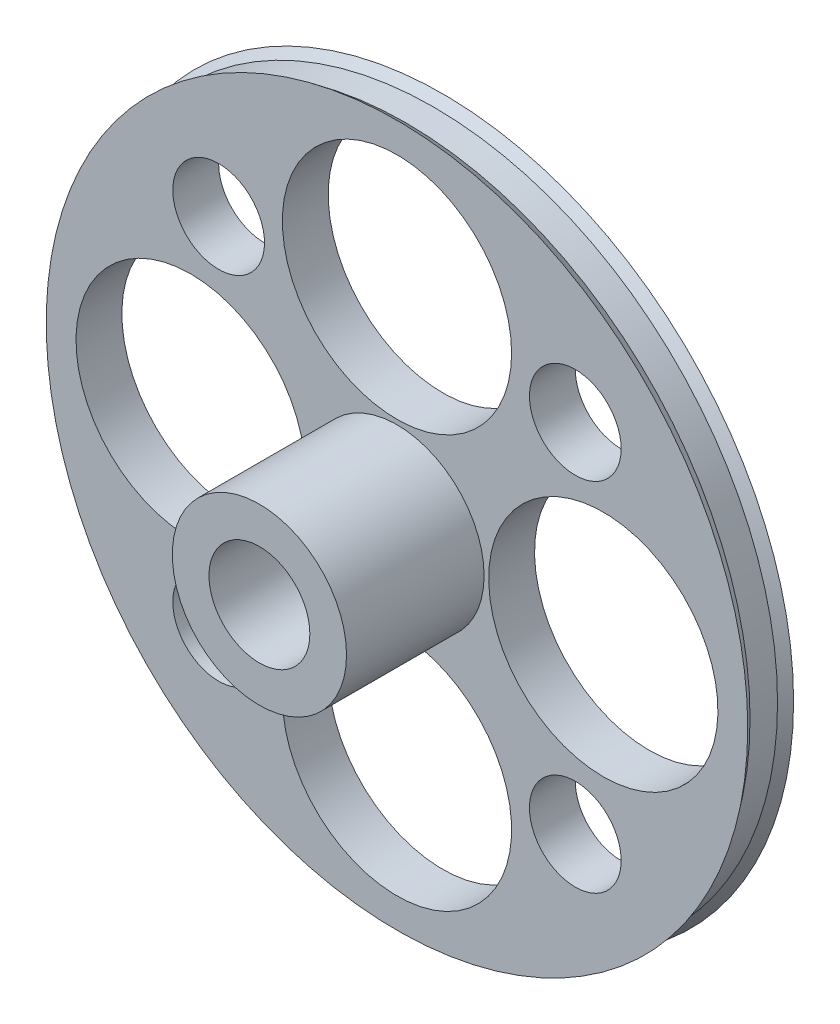
from build123d import *

# Parameters (mm, degrees)
SKETCH1_R           = 75
BOSS_EXTRUDE1_DEPTH = 10
SKETCH2_R           = 19
BOSS_EXTRUDE2_DEPTH = 30
SKETCH3_R           = 11
CUT_EXTRUDE1_DEPTH  = 114.357840488
SKETCH5_R           = 25
CUT_EXTRUDE2_DEPTH  = 113.269764407
CIRPATTERN1_COUNT   = 4
SKETCH6_R           = 10
CUT_EXTRUDE3_DEPTH  = 113.269764407
CIRPATTERN2_COUNT   = 4


with BuildPart() as part:
    # Sketch1 → Boss-Extrude1 (new body)
    with BuildSketch(Plane.XY):
        Circle(SKETCH1_R)
    extrude(amount=BOSS_EXTRUDE1_DEPTH)

    # Sketch2 → Boss-Extrude2 (add)
    with BuildSketch(Plane.XY.offset(10)):
        Circle(SKETCH2_R)
    extrude(amount=BOSS_EXTRUDE2_DEPTH)

    # Sketch3 → Cut-Extrude1 (cut, through all)
    with BuildSketch(Plane.XY.offset(40)):
        Circle(SKETCH3_R)
    extrude(amount=-CUT_EXTRUDE1_DEPTH, mode=Mode.SUBTRACT)

    # Sketch4 → Revolve1 (revolve)
    with BuildSketch(Plane(origin=(0, 0, 0), x_dir=(1, 0, 0), z_dir=(0, 1, 0))):
        Polygon((75, 0), (76.5, 0), (75, -2), align=None)
        Polygon((75, -10), (76.5, -10), (75, -8), align=None)
    revolve(axis=Axis((0, 0, 40), (0, 0, -1)))

    # Sketch5 → Cut-Extrude2 (cut, through all)
    with BuildSketch(Plane.XY.offset(10)):
        with Locations((0, 45)):
            Circle(SKETCH5_R)
    cut_extrude2 = extrude(amount=-CUT_EXTRUDE2_DEPTH, mode=Mode.SUBTRACT)

    # CirPattern1: Cut-Extrude2 ×4 about axis
    cirpattern1_axis = Axis((0, 0, 0), (0, 0, 1))
    for i in range(1, CIRPATTERN1_COUNT):
        add(cut_extrude2.rotate(cirpattern1_axis, i * 360 / CIRPATTERN1_COUNT), mode=Mode.SUBTRACT)

    # Sketch6 → Cut-Extrude3 (cut, through all)
    with BuildSketch(Plane.XY.offset(10)):
        with Locations((38.890872965, 38.890872965)):
            Circle(SKETCH6_R)
    cut_extrude3 = extrude(amount=-CUT_EXTRUDE3_DEPTH, mode=Mode.SUBTRACT)

    # CirPattern2: Cut-Extrude3 ×4 about axis
    cirpattern2_axis = Axis((0, 0, 0), (0, 0, 1))
    for i in range(1, CIRPATTERN2_COUNT):
        add(cut_extrude3.rotate(cirpattern2_axis, i * 360 / CIRPATTERN2_COUNT), mode=Mode.SUBTRACT)


solid = part.part
